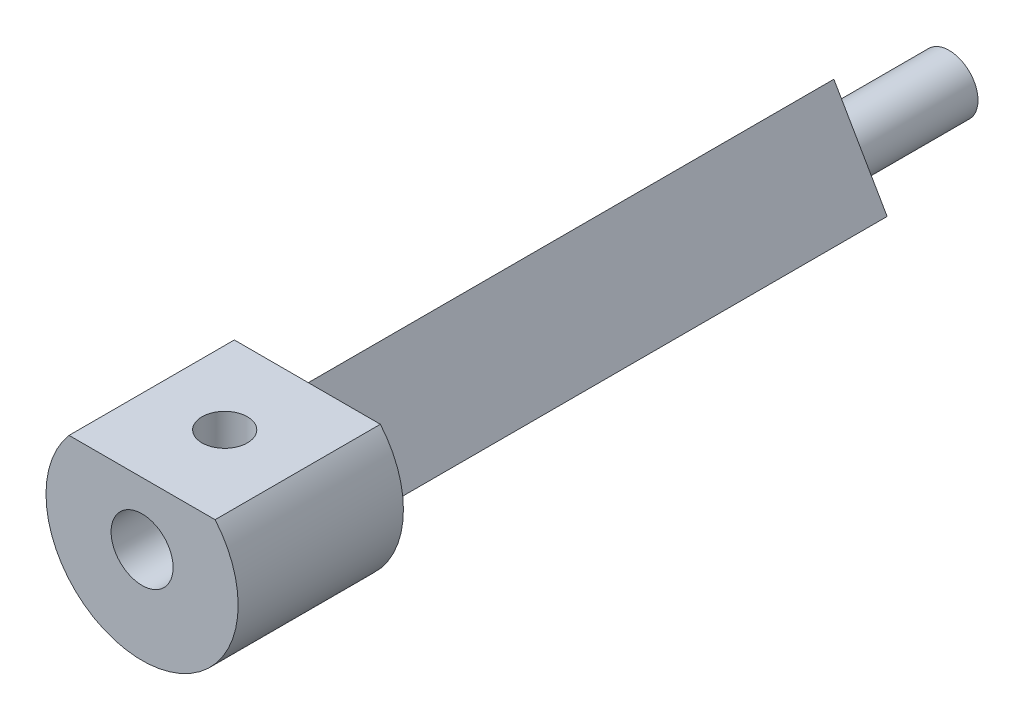
from build123d import *

# Parameters (mm, degrees)
SKETCH2_R           = 6.35
BOSS_EXTRUDE1_DEPTH = 10.922
SKETCH3_W           = 11.565028963
SKETCH3_H           = 5.944743938
CUT_EXTRUDE1_DEPTH  = 15.24
SKETCH4_R           = 1.5
CUT_EXTRUDE2_DEPTH  = 5.08
SKETCH6_R           = 2.05
CUT_EXTRUDE3_DEPTH  = 10.16
BOSS_EXTRUDE2_DEPTH = 34.798
SKETCH9_R           = 1.905
BOSS_EXTRUDE3_DEPTH = 7.62


with BuildPart() as part:
    # Sketch2 → Boss-Extrude1 (new body)
    with BuildSketch(Plane.XY):
        Circle(SKETCH2_R)
    extrude(amount=BOSS_EXTRUDE1_DEPTH)

    # Sketch3 → Cut-Extrude1 (cut)
    with BuildSketch(Plane.XY.offset(10.922)):
        with Locations((0.956423272, 7.099276819)):
            Rectangle(SKETCH3_W, SKETCH3_H)
    extrude(amount=-CUT_EXTRUDE1_DEPTH, mode=Mode.SUBTRACT)

    # Sketch4 → Cut-Extrude2 (cut)
    with BuildSketch(Plane(origin=(0, 4.12690485, 0), x_dir=(1, 0, 0), z_dir=(0, 1, 0))):
        with Locations(Location((0, -5.461, 0), (0, 0, 270))):
            Circle(SKETCH4_R)
    extrude(amount=-CUT_EXTRUDE2_DEPTH, mode=Mode.SUBTRACT)

    # Sketch6 → Cut-Extrude3 (cut)
    with BuildSketch(Plane.XY.offset(10.922)):
        Circle(SKETCH6_R)
    extrude(amount=-CUT_EXTRUDE3_DEPTH, mode=Mode.SUBTRACT)

    # Sketch8 → Boss-Extrude2 (add)
    with BuildSketch(Plane(origin=(0, 0, 0), x_dir=(-1, 0, 0), z_dir=(0, 0, -1))):
        Polygon((0, 4.064), (-3.519527241, -2.032), (3.519527241, -2.032), align=None)
    extrude(amount=BOSS_EXTRUDE2_DEPTH)

    # Sketch9 → Boss-Extrude3 (add)
    with BuildSketch(Plane(origin=(0, 0, -34.798), x_dir=(-1, 0, 0), z_dir=(0, 0, -1))):
        with Locations(Location((0, 0, 0), (0, 0, 180))):
            Circle(SKETCH9_R)
    extrude(amount=BOSS_EXTRUDE3_DEPTH)


solid = part.part
